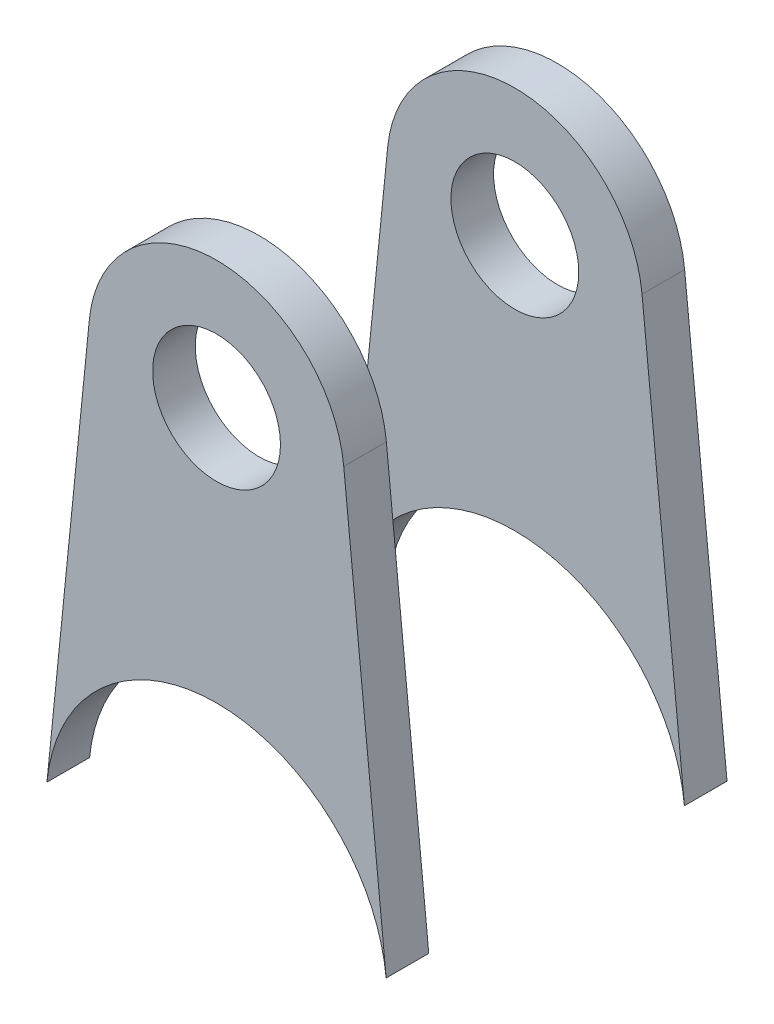
from build123d import *

# Parameters (mm, degrees)
BOSS_EXTRUDE1_START = 12.7
SKETCH1_R           = 4.7625
BOSS_EXTRUDE1_DEPTH = 3.175
BOSS_EXTRUDE2_START = -12.7
SKETCH1_4_R         = 4.7625
BOSS_EXTRUDE2_DEPTH = 3.175


with BuildPart() as part:
    # Sketch1 → Boss-Extrude1 (new body)
    with BuildSketch(Plane.XY.offset(BOSS_EXTRUDE1_START)):
        with BuildLine():
            ThreePointArc((9.477255338, 0.9525), (0, 9.525), (-9.477255338, 0.9525))
            Line((-9.477255338, 0.9525), (-12.636340451, -30.48))
            ThreePointArc((-12.636340451, -30.48), (0, -19.05), (12.636340451, -30.48))
            Line((12.636340451, -30.48), (9.477255338, 0.9525))
        make_face()
        Circle(SKETCH1_R, mode=Mode.SUBTRACT)
    extrude(amount=-BOSS_EXTRUDE1_DEPTH)


with BuildPart() as body_2:
    # Sketch1<4> → Boss-Extrude2 (new body)
    with BuildSketch(Plane.XY.offset(BOSS_EXTRUDE2_START)):
        with BuildLine():
            ThreePointArc((9.477255338, 0.9525), (0, 9.525), (-9.477255338, 0.9525))
            Line((-9.477255338, 0.9525), (-12.636340451, -30.48))
            ThreePointArc((-12.636340451, -30.48), (0, -19.05), (12.636340451, -30.48))
            Line((12.636340451, -30.48), (9.477255338, 0.9525))
        make_face()
        Circle(SKETCH1_4_R, mode=Mode.SUBTRACT)
    extrude(amount=BOSS_EXTRUDE2_DEPTH)


solid = Compound([part.part, body_2.part])
